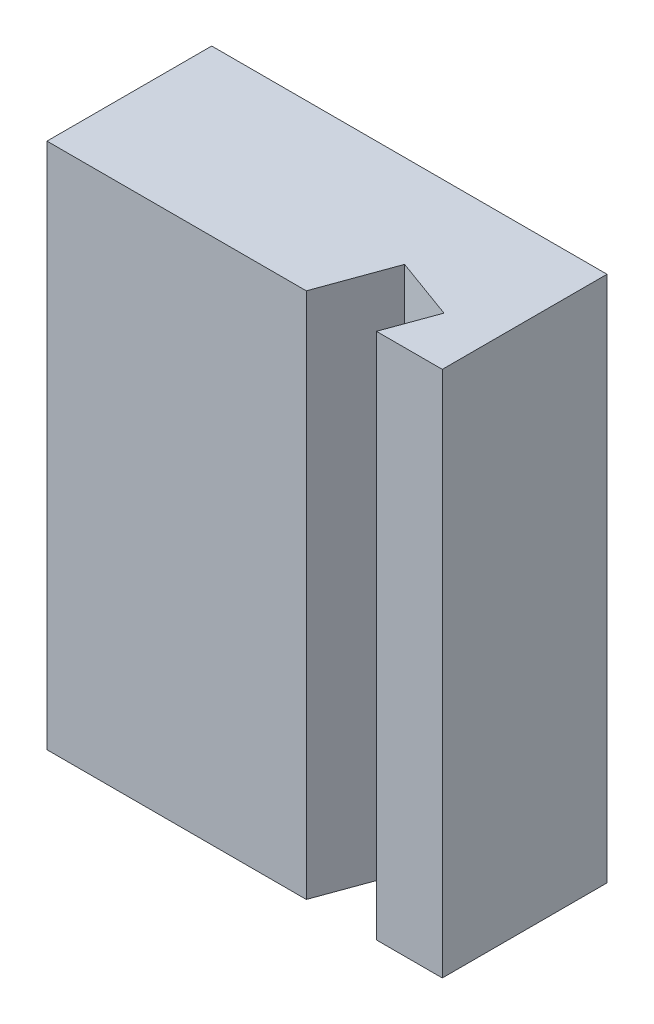
from build123d import *

# Parameters (mm, degrees)
BOSS_EXTRUDE1_DEPTH = 40


with BuildPart() as part:
    # Sketch1 → Boss-Extrude1 (new, symmetric)
    with BuildSketch(Plane(origin=(0, 0, 0), x_dir=(-1, 0, 0), z_dir=(0, 1, 0))):
        Polygon((-20, 12.5), (-22.736161147, 4.982459034), (-13.339234939, 1.5622576), (-9.358222275, 12.5), (30, 12.5), (30, -12.5), (-30, -12.5), (-30, 12.5), align=None)
    extrude(amount=BOSS_EXTRUDE1_DEPTH, both=True)


solid = part.part
